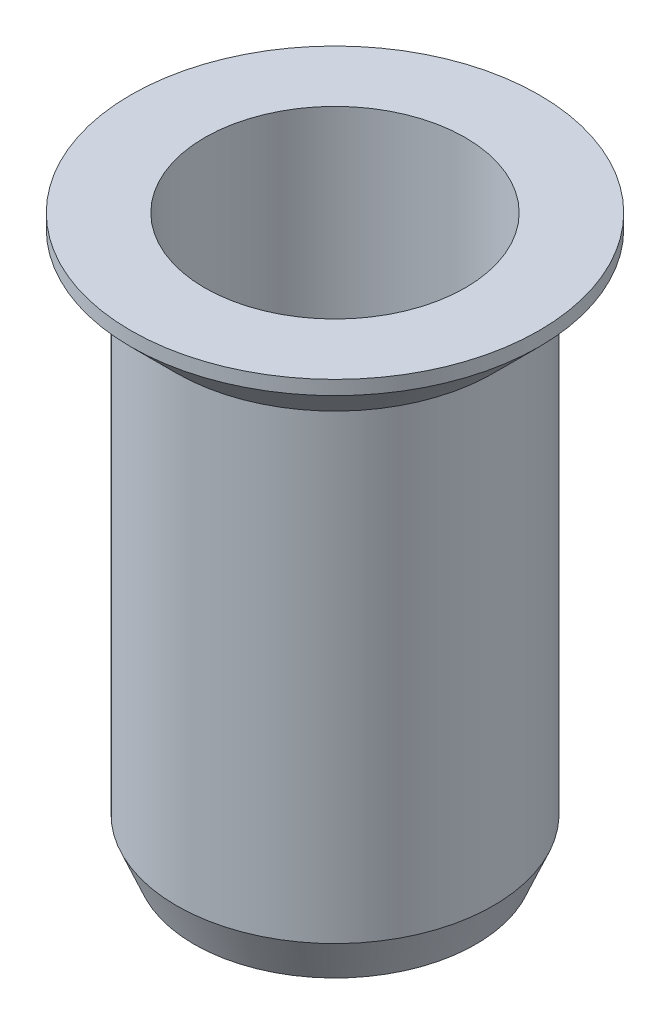
from build123d import *


with BuildPart() as part:
    # Esquisse1 → Révolution1 (revolve)
    with BuildSketch(Plane.XY, mode=Mode.PRIVATE) as r_volution1_sk:
        Polygon((3.7, 9), (3.7, 16), (5.8, 16), (5.8, 15.6), (4.5, 14.3), (4.5, 1.2), (4, 0), (3.7, 0), (3, 0), (3, 9), align=None)
    revolve(r_volution1_sk.sketch.rotate(Axis((0, 0, 0), (0, 1, 0)), 90), axis=Axis((0, 0, 0), (0, 1, 0)))


solid = part.part
